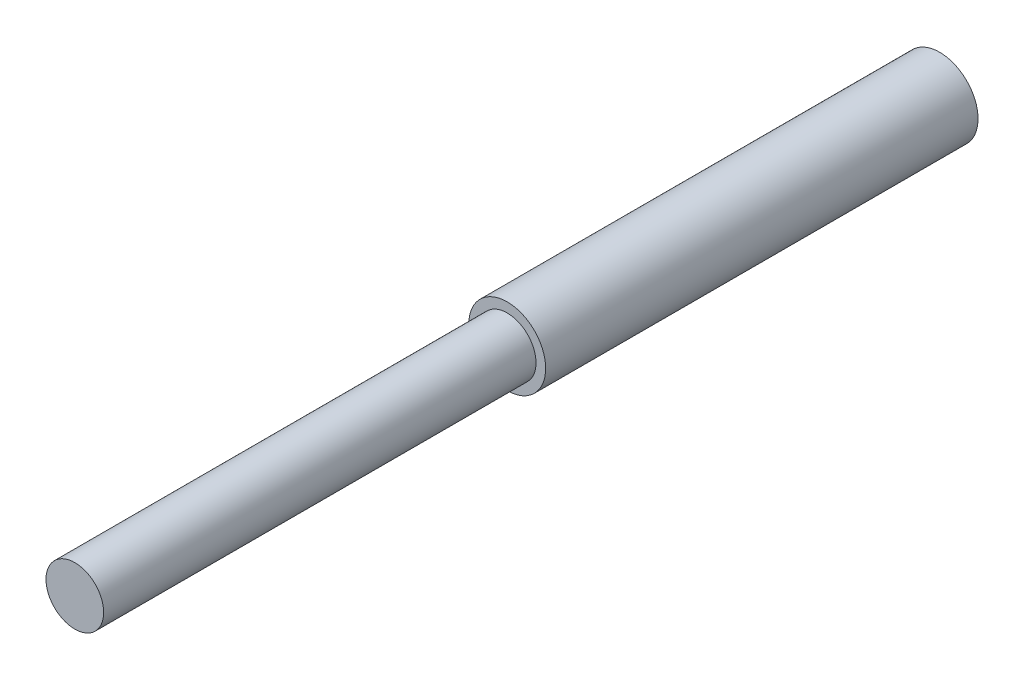
from build123d import *

# Parameters (mm, degrees)
SKETCH1_R           = 4
BOSS_EXTRUDE1_DEPTH = 45
SKETCH2_R           = 3
BOSS_EXTRUDE2_DEPTH = 45


with BuildPart() as part:
    # Sketch1 → Boss-Extrude1 (new body)
    with BuildSketch(Plane.XY):
        with Locations(Location((0, 0, 0), (0, 0, 180))):
            Circle(SKETCH1_R)
    extrude(amount=BOSS_EXTRUDE1_DEPTH)

    # Sketch2 → Boss-Extrude2 (add)
    with BuildSketch(Plane.XY.offset(45)):
        with Locations(Location((0, 0, 0), (0, 0, 180))):
            Circle(SKETCH2_R)
    extrude(amount=BOSS_EXTRUDE2_DEPTH)


solid = part.part
